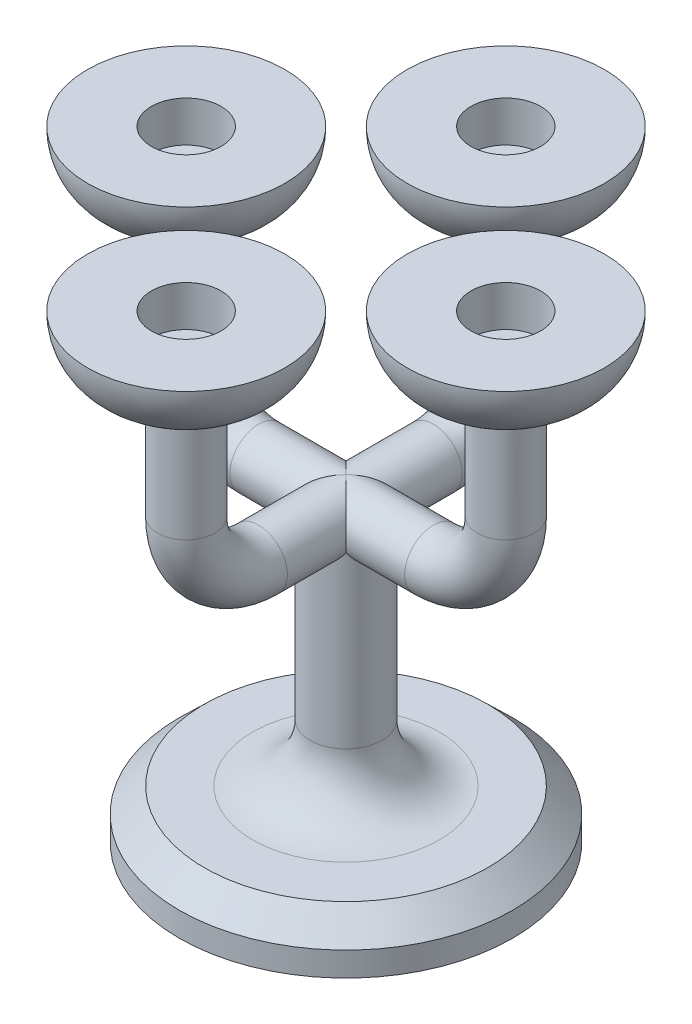
from build123d import *

# Parameters (mm, degrees)
FILLET1_R         = 10
SWEEP1_PROFILE_R  = 5
CIRPATTERN2_COUNT = 4


with BuildPart() as part:
    # Sketch1 → Revolve1 (revolve)
    with BuildSketch(Plane.XY, mode=Mode.PRIVATE) as revolve1_sk:
        Polygon((0, 0), (0, 50.354961658), (6.258808794, 50.354961658), (6.258808794, 8.439908828), (24.655913429, 8.439908828), (29.018113498, 4.219954414), (29.018113498, 0), align=None)
    revolve(revolve1_sk.sketch.rotate(Axis((0, 0, 0), (0, 1, 0)), 90), axis=Axis((0, 0, 0), (0, 1, 0)))

    # Fillet1
    fillet1_edges = [part.edges().sort_by_distance(p)[0] for p in [
        (0, 8.439908828, 6.258808794),
    ]]
    fillet(fillet1_edges, radius=FILLET1_R)

    # Sweep1: sweep along a path in Sketch3
    with BuildLine(Plane.XY) as sweep1_path:
        Line((0, 50.354961658), (15.205877002, 50.354961658))
        ThreePointArc((15.205877002, 50.354961658), (24.112589329, 54.0442427), (27.801870371, 62.950955027))
        Line((27.801870371, 62.950955027), (27.801870371, 82.804298784))
    # Sweep1 profile (on start of the path) → Sweep1 (sweep)
    with BuildSketch(Plane(origin=(0, 50.354961658, 0), x_dir=(0, 0, 1), z_dir=(1, 0, 0))):
        Circle(SWEEP1_PROFILE_R)
    sweep1 = sweep(path=sweep1_path.line)

    # Sketch9 → Revolve2 (revolve)
    with BuildSketch(Plane.XY, mode=Mode.PRIVATE) as revolve2_sk:
        with BuildLine():
            Line((27.801870371, 82.804298784), (33.858057508, 82.804298784))
            ThreePointArc((33.858057508, 82.804298784), (41.716409419, 86.059334723), (44.971445358, 93.917686633))
            Line((44.971445358, 93.917686633), (33.858057508, 93.917686633))
            Line((33.858057508, 93.917686633), (33.858057508, 86.830137489))
            Line((33.858057508, 86.830137489), (27.801870371, 86.830137489))
            Line((27.801870371, 86.830137489), (27.801870371, 82.804298784))
        make_face()
    revolve2 = revolve(revolve2_sk.sketch.rotate(Axis((27.801870371, 86.830137489, 0), (0, -1, 0)), 90), axis=Axis((27.801870371, 86.830137489, 0), (0, -1, 0)))

    # CirPattern2: Sweep1, Revolve2 ×4 about axis
    cirpattern2_axis = Axis((0, 0, 0), (0, 1, 0))
    add([sweep1.rotate(cirpattern2_axis, i * 360 / CIRPATTERN2_COUNT) for i in range(1, CIRPATTERN2_COUNT)])
    add([revolve2.rotate(cirpattern2_axis, i * 360 / CIRPATTERN2_COUNT) for i in range(1, CIRPATTERN2_COUNT)])


solid = part.part
